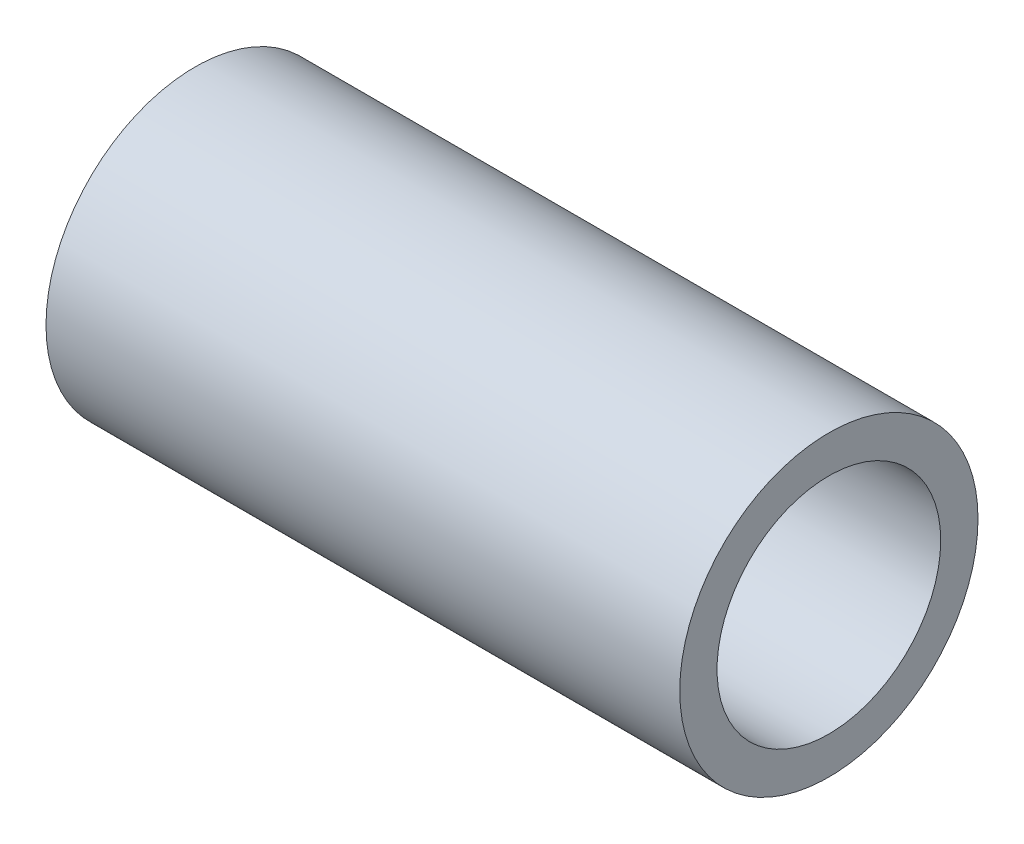
from build123d import *

# Parameters (mm, degrees)
SKETCH1_R           = 4
SKETCH1_R_2         = 3
BOSS_EXTRUDE1_DEPTH = 17


with BuildPart() as part:
    # Sketch1 → Boss-Extrude1 (new body)
    with BuildSketch(Plane(origin=(0, 0, 0), x_dir=(0, 0, -1), z_dir=(1, 0, 0))):
        Circle(SKETCH1_R)
        Circle(SKETCH1_R_2, mode=Mode.SUBTRACT)
    extrude(amount=BOSS_EXTRUDE1_DEPTH)


solid = part.part
